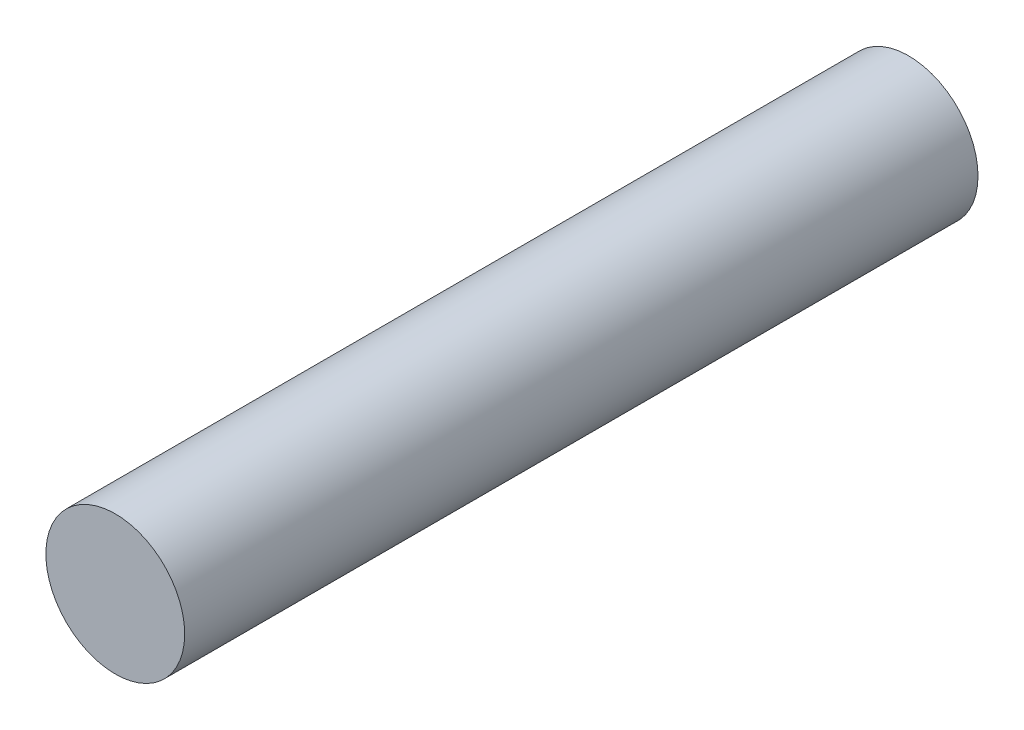
from build123d import *

# Parameters (mm, degrees)
SKETCH1_R           = 10.5
BOSS_EXTRUDE1_DEPTH = 120


with BuildPart() as part:
    # Sketch1 → Boss-Extrude1 (new body)
    with BuildSketch(Plane.XY):
        Circle(SKETCH1_R)
    extrude(amount=BOSS_EXTRUDE1_DEPTH)


solid = part.part
